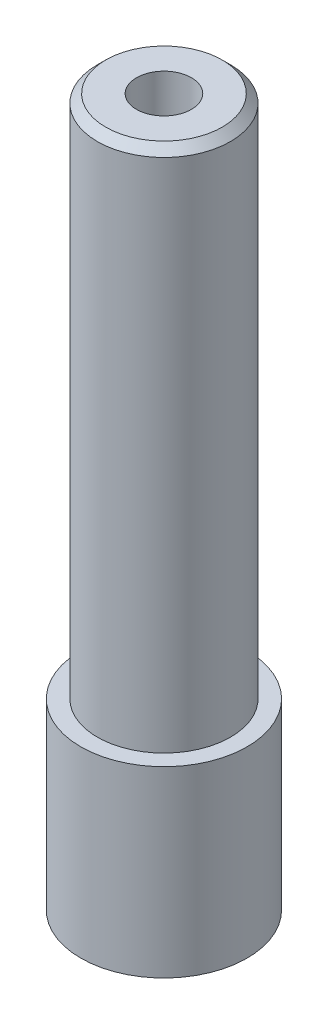
from build123d import *

# Parameters (mm, degrees)
SKETCH_1_R             = 4
EXTRUDE_1_DEPTH        = 21.25
SKETCH_2_W             = 1
SKETCH_2_H             = 11
CHAMFER_1_SIZE         = 0.5
HOLE_WIZARD_M6_2_D     = 5
HOLE_WIZARD_M6_2_DEPTH = 18
HOLE_WIZARD_M6_2_TIP   = 1.502151548
HOLE_WIZARD_M4_1_D     = 3.3
HOLE_WIZARD_M4_1_DEPTH = 25
HOLE_WIZARD_M4_1_TIP   = 0.991420021
SCALE1_SCALE           = 2


with BuildPart() as part:
    # 草图1 → 凸台-拉伸1 (new, symmetric)
    with BuildSketch(Plane(origin=(0, 0, 0), x_dir=(1, 0, 0), z_dir=(0, 1, 0))):
        with Locations(Location((0, 0, 0), (0, 0, 270))):
            Circle(SKETCH_1_R)
    extrude(amount=EXTRUDE_1_DEPTH, both=True)

    # 草图2 → 旋转1 (revolve)
    with BuildSketch(Plane.XY, mode=Mode.PRIVATE) as revolve_1_sk:
        with Locations((4.5, -15.75)):
            Rectangle(SKETCH_2_W, SKETCH_2_H)
    revolve(revolve_1_sk.sketch.rotate(Axis((0, 21.25, 0), (0, -1, 0)), 270), axis=Axis((0, 21.25, 0), (0, -1, 0)))

    # 倒角1
    chamfer_1_edges = [part.edges().sort_by_distance(p)[0] for p in [
        (0, 21.25, -4),
    ]]
    chamfer(chamfer_1_edges, length=CHAMFER_1_SIZE)

    # M6 螺纹孔2
    with Locations(Plane(origin=(0, -21.25, 0), x_dir=(-1, 0, 0), z_dir=(0, -1, 0))):
        with Locations((0, 0)):
            Hole(HOLE_WIZARD_M6_2_D / 2, depth=HOLE_WIZARD_M6_2_DEPTH)
            with Locations((0, 0, -(HOLE_WIZARD_M6_2_DEPTH + HOLE_WIZARD_M6_2_TIP / 2))):  # 118° drill point
                Cone(0, HOLE_WIZARD_M6_2_D / 2, HOLE_WIZARD_M6_2_TIP, mode=Mode.SUBTRACT)

    # M4 螺纹孔1
    with Locations(Plane(origin=(0, 21.25, 0), x_dir=(1, 0, 0), z_dir=(0, 1, 0))):
        with Locations((0, 0)):
            Hole(HOLE_WIZARD_M4_1_D / 2, depth=HOLE_WIZARD_M4_1_DEPTH)
            with Locations((0, 0, -(HOLE_WIZARD_M4_1_DEPTH + HOLE_WIZARD_M4_1_TIP / 2))):  # 118° drill point
                Cone(0, HOLE_WIZARD_M4_1_D / 2, HOLE_WIZARD_M4_1_TIP, mode=Mode.SUBTRACT)


with BuildPart() as part_1:
    # Scale1: scaled about (0, -1.336200342, 0)
    add(part.part.scale(SCALE1_SCALE).moved(Location((0, 1.336200342, 0))))


solid = part_1.part
